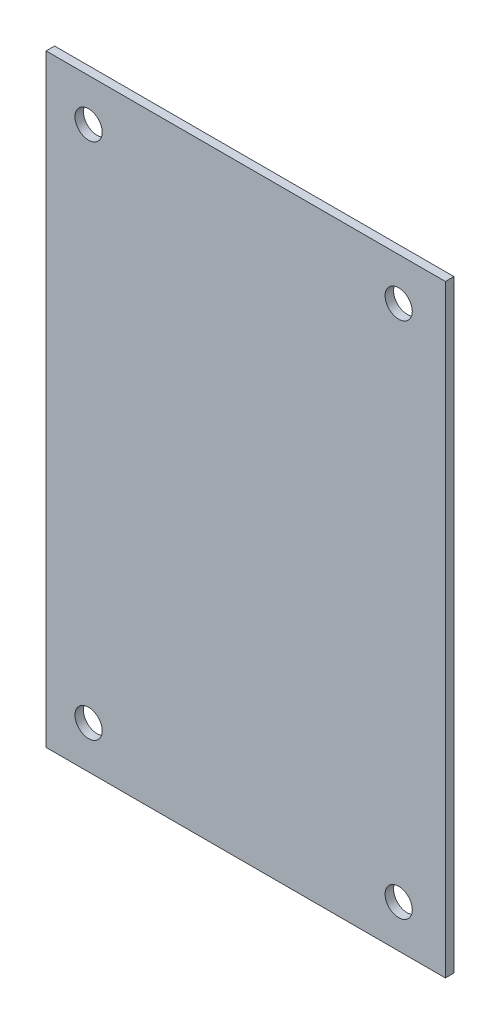
from build123d import *

# Parameters (mm, degrees)
SKETCH_1_W                  = 47
SKETCH_1_H                  = 71
EXTRUDE_1_DEPTH             = 1
SKETCH_2_R                  = 1.6
CUT_EXTRUDE_1_DEPTH         = 1
PATTERN_LINEAR_1_COUNT      = 2
PATTERN_LINEAR_1_PITCH      = 36.5
PATTERN_LINEAR_1_COUNT_DIR2 = 2
PATTERN_LINEAR_1_PITCH_DIR2 = 61


with BuildPart() as part:
    # ｽｹｯﾁ1 → ﾎﾞｽ - 押し出し1 (new body)
    with BuildSketch(Plane.XY):
        Rectangle(SKETCH_1_W, SKETCH_1_H)
    extrude(amount=EXTRUDE_1_DEPTH)

    # ｽｹｯﾁ2 → ｶｯﾄ - 押し出し1 (cut)
    with BuildSketch(Plane.XY.offset(1)):
        with Locations((-18.5, -30.5)):
            Circle(SKETCH_2_R)
    cut_extrude_1 = extrude(amount=-CUT_EXTRUDE_1_DEPTH, mode=Mode.SUBTRACT)

    # 直線ﾊﾟﾀｰﾝ1: Cut-Extrude 1 2 × 2
    with Locations(*[(i * PATTERN_LINEAR_1_PITCH, j * PATTERN_LINEAR_1_PITCH_DIR2, 0) for i in range(PATTERN_LINEAR_1_COUNT) for j in range(PATTERN_LINEAR_1_COUNT_DIR2) if (i, j) != (0, 0)]):
        add(cut_extrude_1, mode=Mode.SUBTRACT)


solid = part.part
